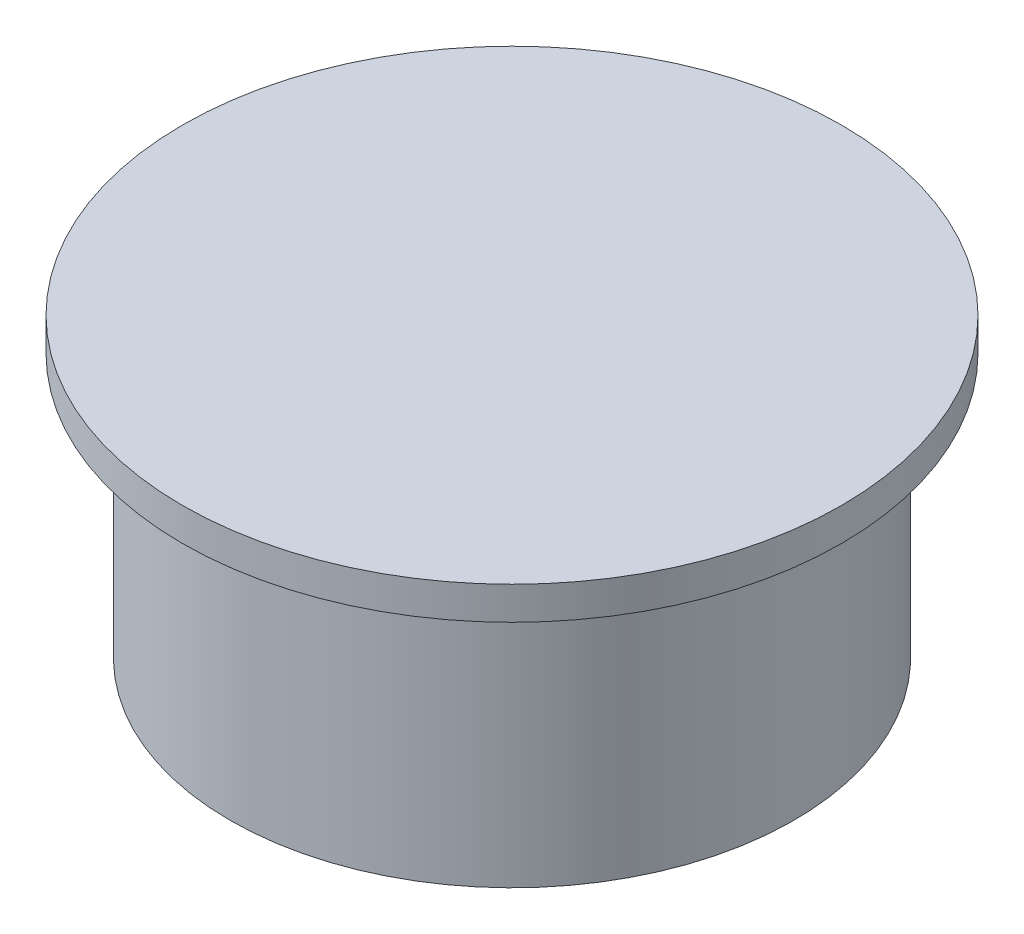
from build123d import *

# Parameters (mm, degrees)
SKETCH2_R           = 21.384776311
SKETCH2_W           = 26
SKETCH2_H           = 26
BOSS_EXTRUDE1_DEPTH = 10
SKETCH4_R           = 25
BOSS_EXTRUDE2_DEPTH = 2.5
FILLET1_R           = 2


with BuildPart() as part:
    # Sketch2 → Boss-Extrude1 (new, symmetric)
    with BuildSketch(Plane(origin=(0, 0, 0), x_dir=(1, 0, 0), z_dir=(0, 1, 0))):
        with Locations(Location((0, 0, 0), (0, 0, 270))):
            Circle(SKETCH2_R)
        Rectangle(SKETCH2_W, SKETCH2_H, mode=Mode.SUBTRACT)
    extrude(amount=BOSS_EXTRUDE1_DEPTH, both=True)

    # Sketch4 → Boss-Extrude2 (add)
    with BuildSketch(Plane(origin=(0, 10, 0), x_dir=(1, 0, 0), z_dir=(0, 1, 0))):
        with Locations(Location((0, 0, 0), (0, 0, 270))):
            Circle(SKETCH4_R)
    extrude(amount=BOSS_EXTRUDE2_DEPTH)

    # Fillet1
    fillet1_edges = [part.edges().sort_by_distance(p)[0] for p in [
        (0, 10, -21.384776311),
    ]]
    fillet(fillet1_edges, radius=FILLET1_R)


solid = part.part
